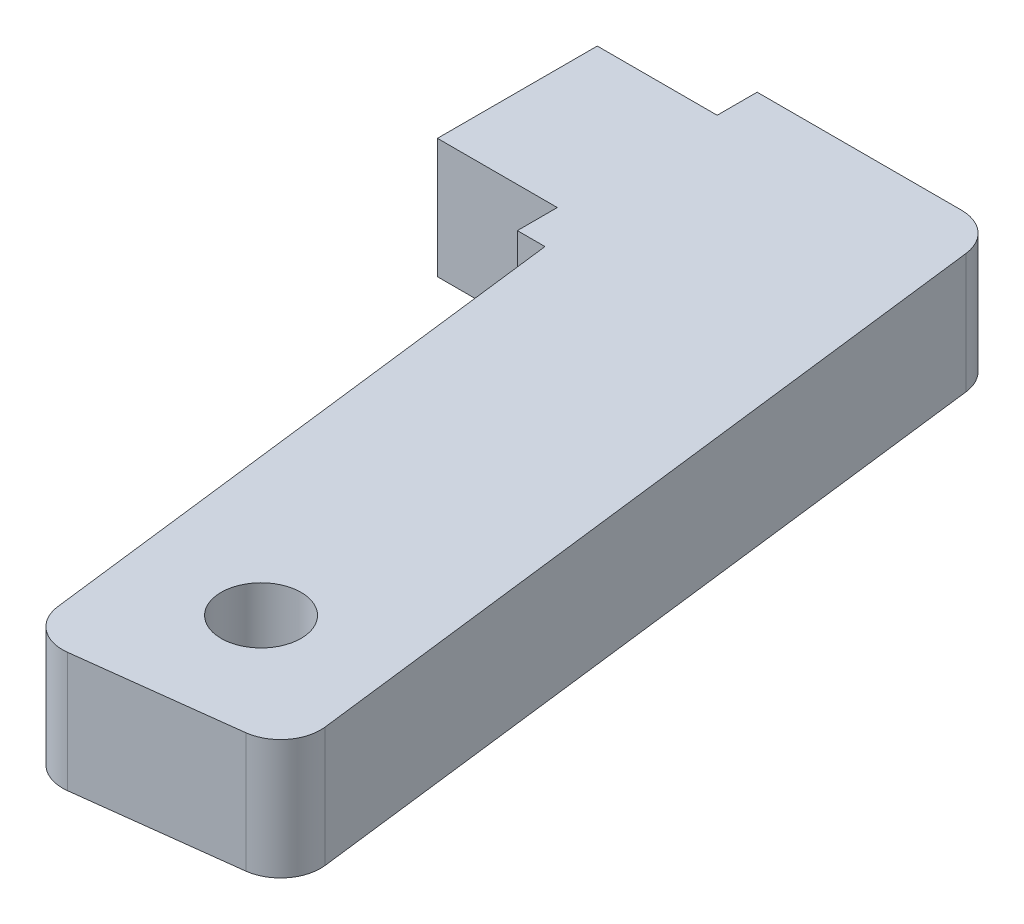
from build123d import *

# Parameters (mm, degrees)
SKETCH2_R           = 1
BOSS_EXTRUDE1_DEPTH = 3
FILLET1_R           = 1


with BuildPart() as part:
    # Sketch2 → Boss-Extrude1 (new body)
    with BuildSketch(Plane(origin=(0, 0, 0), x_dir=(1, 0, 0), z_dir=(0, 1, 0))):
        Polygon((20.748238747, 19.933341623), (14.748238747, 19.933341623), (14.748238747, 18.933341623), (11.748238747, 18.933341623), (11.748238747, 14.933341623), (14.748238747, 14.933341623), (14.748238747, 13.933341623), (15.43988716, 13.933341623), (17.267927311, -0.954850651), (23.22320422, -0.223634591), align=None)
        with Locations(Location((19.879957735, 2.388395834, 0), (0, 0, 270))):
            Circle(SKETCH2_R, mode=Mode.SUBTRACT)
    extrude(amount=BOSS_EXTRUDE1_DEPTH)

    # Fillet1
    fillet1_edges = [part.edges().sort_by_distance(p)[0] for p in [
        (20.748238747, 1.5, -19.933341623),
        (23.22320422, 1.5, 0.223634591),
        (17.267927311, 1.5, 0.954850651),
    ]]
    fillet(fillet1_edges, radius=FILLET1_R)


solid = part.part
